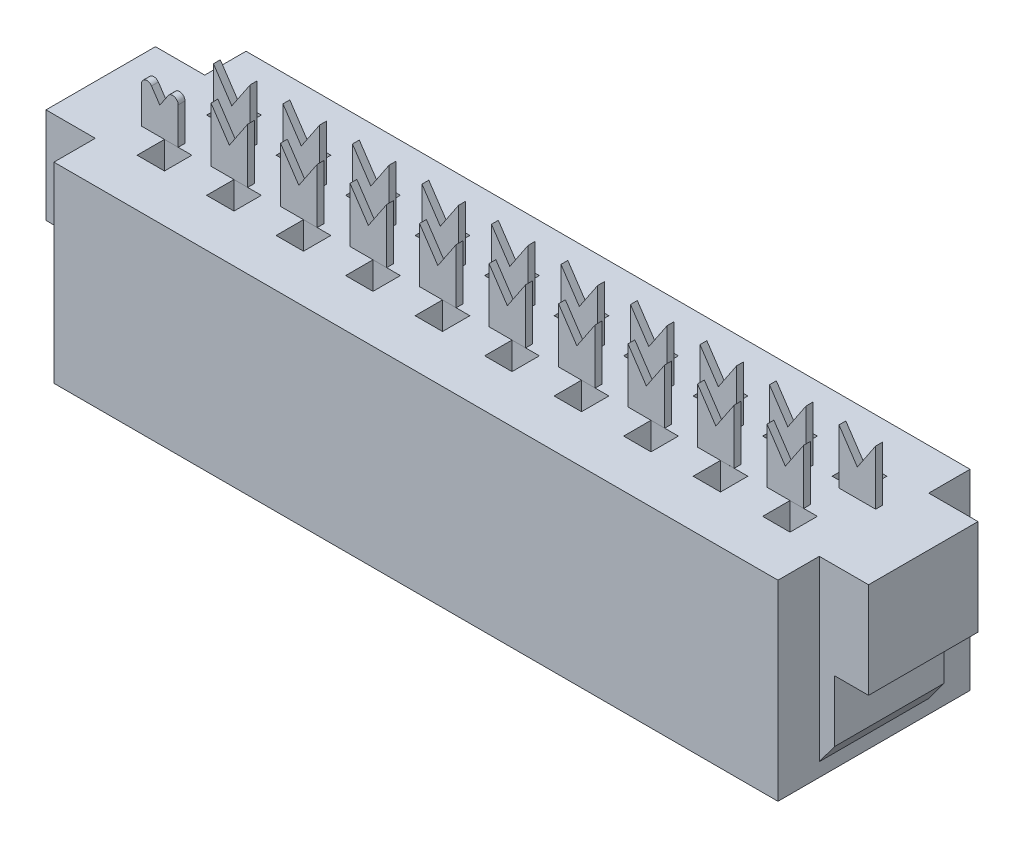
from build123d import *

# Parameters (mm, degrees)
SKETCH_1_W          = 1
SKETCH_1_H          = 1
EXTRUDE_1_DEPTH     = 7
SKETCH_5_W          = 1.34
SKETCH_5_H          = 0.25
EXTRUDE_3_DEPTH     = 2
EXTRUDE_3_2_DEPTH   = 2
EXTRUDE_3_3_DEPTH   = 2
EXTRUDE_3_4_DEPTH   = 2
EXTRUDE_3_5_DEPTH   = 2
EXTRUDE_3_6_DEPTH   = 2
EXTRUDE_3_7_DEPTH   = 2
EXTRUDE_3_8_DEPTH   = 2
EXTRUDE_3_9_DEPTH   = 2
EXTRUDE_3_10_DEPTH  = 2
EXTRUDE_3_11_DEPTH  = 2
EXTRUDE_3_12_DEPTH  = 2
EXTRUDE_3_13_DEPTH  = 2
EXTRUDE_3_14_DEPTH  = 2
EXTRUDE_3_15_DEPTH  = 2
EXTRUDE_3_16_DEPTH  = 2
EXTRUDE_3_17_DEPTH  = 2
EXTRUDE_3_18_DEPTH  = 2
EXTRUDE_3_19_DEPTH  = 2
EXTRUDE_3_20_DEPTH  = 2
CUT_EXTRUDE_1_DEPTH = 0.25
CUT_EXTRUDE_2_DEPTH = 0.25
CUT_EXTRUDE_START   = -5.51
CUT_EXTRUDE_3_DEPTH = 4
FILLET_1_R          = 0.2


with BuildPart() as part:
    # Эскиз1 → Бобышка-Вытянуть1 (new body)
    with BuildSketch(Plane(origin=(0, 0, 0), x_dir=(1, 0, 0), z_dir=(0, 1, 0))):
        Polygon((26.46, -0.73), (26.46, 3.27), (24.66, 3.27), (24.66, 4.78), (-1.8, 4.78), (-1.8, 3.27), (-3.6, 3.27), (-3.6, -0.73), (-1.8, -0.73), (-1.8, -2.24), (24.66, -2.24), (24.66, -0.73), align=None)
        Rectangle(SKETCH_1_W, SKETCH_1_H, mode=Mode.SUBTRACT)
        with Locations((2.54, 0)):
            Rectangle(SKETCH_1_W, SKETCH_1_H, mode=Mode.SUBTRACT)
        with Locations((2.54, 2.54)):
            Rectangle(SKETCH_1_W, SKETCH_1_H, mode=Mode.SUBTRACT)
        with Locations((0, 2.54)):
            Rectangle(SKETCH_1_W, SKETCH_1_H, mode=Mode.SUBTRACT)
        with Locations((5.08, 0)):
            Rectangle(SKETCH_1_W, SKETCH_1_H, mode=Mode.SUBTRACT)
        with Locations((7.62, 0)):
            Rectangle(SKETCH_1_W, SKETCH_1_H, mode=Mode.SUBTRACT)
        with Locations((10.16, 0)):
            Rectangle(SKETCH_1_W, SKETCH_1_H, mode=Mode.SUBTRACT)
        with Locations((12.7, 0)):
            Rectangle(SKETCH_1_W, SKETCH_1_H, mode=Mode.SUBTRACT)
        with Locations((15.24, 0)):
            Rectangle(SKETCH_1_W, SKETCH_1_H, mode=Mode.SUBTRACT)
        with Locations((17.78, 0)):
            Rectangle(SKETCH_1_W, SKETCH_1_H, mode=Mode.SUBTRACT)
        with Locations((20.32, 0)):
            Rectangle(SKETCH_1_W, SKETCH_1_H, mode=Mode.SUBTRACT)
        with Locations((22.86, 0)):
            Rectangle(SKETCH_1_W, SKETCH_1_H, mode=Mode.SUBTRACT)
        with Locations((5.08, 2.54)):
            Rectangle(SKETCH_1_W, SKETCH_1_H, mode=Mode.SUBTRACT)
        with Locations((7.62, 2.54)):
            Rectangle(SKETCH_1_W, SKETCH_1_H, mode=Mode.SUBTRACT)
        with Locations((10.16, 2.54)):
            Rectangle(SKETCH_1_W, SKETCH_1_H, mode=Mode.SUBTRACT)
        with Locations((12.7, 2.54)):
            Rectangle(SKETCH_1_W, SKETCH_1_H, mode=Mode.SUBTRACT)
        with Locations((15.24, 2.54)):
            Rectangle(SKETCH_1_W, SKETCH_1_H, mode=Mode.SUBTRACT)
        with Locations((17.78, 2.54)):
            Rectangle(SKETCH_1_W, SKETCH_1_H, mode=Mode.SUBTRACT)
        with Locations((20.32, 2.54)):
            Rectangle(SKETCH_1_W, SKETCH_1_H, mode=Mode.SUBTRACT)
        with Locations((22.86, 2.54)):
            Rectangle(SKETCH_1_W, SKETCH_1_H, mode=Mode.SUBTRACT)
    extrude(amount=EXTRUDE_1_DEPTH)

    # Эскиз8 → Вырез-Вытянуть3 (cut)
    with BuildSketch(Plane.XY.offset(2.24).offset(CUT_EXTRUDE_START)):
        Polygon((-1.8, 0), (-1.8, 0.5), (-2.35, 1.25), (-2.35, 3.5), (-3.6, 3.5), (-3.6, 0), align=None)
        Polygon((26.46, 0), (24.66, 0), (24.66, 0.5), (25.21, 1.25), (25.21, 3.5), (26.46, 3.5), align=None)
    extrude(amount=CUT_EXTRUDE_3_DEPTH, mode=Mode.SUBTRACT)


with BuildPart() as body_2:
    # Эскиз5 → Бобышка-Вытянуть3 (new body)
    with BuildSketch(Plane(origin=(0, 7, 0), x_dir=(1, 0, 0), z_dir=(0, 1, 0))):
        with Locations((-0.67, 0.625)):
            Rectangle(SKETCH_5_W, SKETCH_5_H)
    extrude(amount=EXTRUDE_3_DEPTH)


with BuildPart() as body_3:
    # Эскиз5 → Extrude 3 2 (new body)
    with BuildSketch(Plane(origin=(0, 7, 0), x_dir=(1, 0, 0), z_dir=(0, 1, 0))):
        with Locations((0.67, 1.915)):
            Rectangle(SKETCH_5_W, SKETCH_5_H)
    extrude(amount=EXTRUDE_3_2_DEPTH)


with BuildPart() as body_4:
    # Эскиз5 → Extrude 3 3 (new body)
    with BuildSketch(Plane(origin=(0, 7, 0), x_dir=(1, 0, 0), z_dir=(0, 1, 0))):
        with Locations((3.21, 1.915)):
            Rectangle(SKETCH_5_W, SKETCH_5_H)
    extrude(amount=EXTRUDE_3_3_DEPTH)


with BuildPart() as body_5:
    # Эскиз5 → Extrude 3 4 (new body)
    with BuildSketch(Plane(origin=(0, 7, 0), x_dir=(1, 0, 0), z_dir=(0, 1, 0))):
        with Locations((1.87, 0.625)):
            Rectangle(SKETCH_5_W, SKETCH_5_H)
    extrude(amount=EXTRUDE_3_4_DEPTH)


with BuildPart() as body_6:
    # Эскиз5 → Extrude 3 5 (new body)
    with BuildSketch(Plane(origin=(0, 7, 0), x_dir=(1, 0, 0), z_dir=(0, 1, 0))):
        with Locations((5.75, 1.915)):
            Rectangle(SKETCH_5_W, SKETCH_5_H)
    extrude(amount=EXTRUDE_3_5_DEPTH)


with BuildPart() as body_7:
    # Эскиз5 → Extrude 3 6 (new body)
    with BuildSketch(Plane(origin=(0, 7, 0), x_dir=(1, 0, 0), z_dir=(0, 1, 0))):
        with Locations((4.41, 0.625)):
            Rectangle(SKETCH_5_W, SKETCH_5_H)
    extrude(amount=EXTRUDE_3_6_DEPTH)


with BuildPart() as body_8:
    # Эскиз5 → Extrude 3 7 (new body)
    with BuildSketch(Plane(origin=(0, 7, 0), x_dir=(1, 0, 0), z_dir=(0, 1, 0))):
        with Locations((8.29, 1.915)):
            Rectangle(SKETCH_5_W, SKETCH_5_H)
    extrude(amount=EXTRUDE_3_7_DEPTH)


with BuildPart() as body_9:
    # Эскиз5 → Extrude 3 8 (new body)
    with BuildSketch(Plane(origin=(0, 7, 0), x_dir=(1, 0, 0), z_dir=(0, 1, 0))):
        with Locations((6.95, 0.625)):
            Rectangle(SKETCH_5_W, SKETCH_5_H)
    extrude(amount=EXTRUDE_3_8_DEPTH)


with BuildPart() as body_10:
    # Эскиз5 → Extrude 3 9 (new body)
    with BuildSketch(Plane(origin=(0, 7, 0), x_dir=(1, 0, 0), z_dir=(0, 1, 0))):
        with Locations((10.83, 1.915)):
            Rectangle(SKETCH_5_W, SKETCH_5_H)
    extrude(amount=EXTRUDE_3_9_DEPTH)


with BuildPart() as body_11:
    # Эскиз5 → Extrude 3 10 (new body)
    with BuildSketch(Plane(origin=(0, 7, 0), x_dir=(1, 0, 0), z_dir=(0, 1, 0))):
        with Locations((9.49, 0.625)):
            Rectangle(SKETCH_5_W, SKETCH_5_H)
    extrude(amount=EXTRUDE_3_10_DEPTH)


with BuildPart() as body_12:
    # Эскиз5 → Extrude 3 11 (new body)
    with BuildSketch(Plane(origin=(0, 7, 0), x_dir=(1, 0, 0), z_dir=(0, 1, 0))):
        with Locations((13.37, 1.915)):
            Rectangle(SKETCH_5_W, SKETCH_5_H)
    extrude(amount=EXTRUDE_3_11_DEPTH)


with BuildPart() as body_13:
    # Эскиз5 → Extrude 3 12 (new body)
    with BuildSketch(Plane(origin=(0, 7, 0), x_dir=(1, 0, 0), z_dir=(0, 1, 0))):
        with Locations((12.03, 0.625)):
            Rectangle(SKETCH_5_W, SKETCH_5_H)
    extrude(amount=EXTRUDE_3_12_DEPTH)


with BuildPart() as body_14:
    # Эскиз5 → Extrude 3 13 (new body)
    with BuildSketch(Plane(origin=(0, 7, 0), x_dir=(1, 0, 0), z_dir=(0, 1, 0))):
        with Locations((15.91, 1.915)):
            Rectangle(SKETCH_5_W, SKETCH_5_H)
    extrude(amount=EXTRUDE_3_13_DEPTH)


with BuildPart() as body_15:
    # Эскиз5 → Extrude 3 14 (new body)
    with BuildSketch(Plane(origin=(0, 7, 0), x_dir=(1, 0, 0), z_dir=(0, 1, 0))):
        with Locations((14.57, 0.625)):
            Rectangle(SKETCH_5_W, SKETCH_5_H)
    extrude(amount=EXTRUDE_3_14_DEPTH)


with BuildPart() as body_16:
    # Эскиз5 → Extrude 3 15 (new body)
    with BuildSketch(Plane(origin=(0, 7, 0), x_dir=(1, 0, 0), z_dir=(0, 1, 0))):
        with Locations((18.45, 1.915)):
            Rectangle(SKETCH_5_W, SKETCH_5_H)
    extrude(amount=EXTRUDE_3_15_DEPTH)


with BuildPart() as body_17:
    # Эскиз5 → Extrude 3 16 (new body)
    with BuildSketch(Plane(origin=(0, 7, 0), x_dir=(1, 0, 0), z_dir=(0, 1, 0))):
        with Locations((17.11, 0.625)):
            Rectangle(SKETCH_5_W, SKETCH_5_H)
    extrude(amount=EXTRUDE_3_16_DEPTH)


with BuildPart() as body_18:
    # Эскиз5 → Extrude 3 17 (new body)
    with BuildSketch(Plane(origin=(0, 7, 0), x_dir=(1, 0, 0), z_dir=(0, 1, 0))):
        with Locations((20.99, 1.915)):
            Rectangle(SKETCH_5_W, SKETCH_5_H)
    extrude(amount=EXTRUDE_3_17_DEPTH)


with BuildPart() as body_19:
    # Эскиз5 → Extrude 3 18 (new body)
    with BuildSketch(Plane(origin=(0, 7, 0), x_dir=(1, 0, 0), z_dir=(0, 1, 0))):
        with Locations((19.65, 0.625)):
            Rectangle(SKETCH_5_W, SKETCH_5_H)
    extrude(amount=EXTRUDE_3_18_DEPTH)


with BuildPart() as body_20:
    # Эскиз5 → Extrude 3 19 (new body)
    with BuildSketch(Plane(origin=(0, 7, 0), x_dir=(1, 0, 0), z_dir=(0, 1, 0))):
        with Locations((23.53, 1.915)):
            Rectangle(SKETCH_5_W, SKETCH_5_H)
    extrude(amount=EXTRUDE_3_19_DEPTH)


with BuildPart() as body_21:
    # Эскиз5 → Extrude 3 20 (new body)
    with BuildSketch(Plane(origin=(0, 7, 0), x_dir=(1, 0, 0), z_dir=(0, 1, 0))):
        with Locations((22.19, 0.625)):
            Rectangle(SKETCH_5_W, SKETCH_5_H)
    extrude(amount=EXTRUDE_3_20_DEPTH)


with BuildPart() as cut_extrude_1_tool:
    # Эскиз6 → Вырез-Вытянуть1 (new body)
    with BuildSketch(Plane.XY.offset(-0.5)):
        Polygon((0, 9), (-1.34, 9), (-0.67, 8), align=None)
        Polygon((1.87, 8), (2.54, 9), (1.2, 9), align=None)
        Polygon((4.41, 8), (5.08, 9), (3.74, 9), align=None)
        Polygon((6.95, 8), (7.62, 9), (6.28, 9), align=None)
        Polygon((9.49, 8), (10.16, 9), (8.82, 9), align=None)
        Polygon((12.03, 8), (12.7, 9), (11.36, 9), align=None)
        Polygon((14.57, 8), (15.24, 9), (13.9, 9), align=None)
        Polygon((17.11, 8), (17.78, 9), (16.44, 9), align=None)
        Polygon((19.65, 8), (20.32, 9), (18.98, 9), align=None)
        Polygon((22.19, 8), (22.86, 9), (21.52, 9), align=None)
    extrude(amount=-CUT_EXTRUDE_1_DEPTH)


with BuildPart() as body_2_1:
    add(body_2.part)

    # Вырез-Вытянуть1: cut by cut_extrude_1_tool
    add(cut_extrude_1_tool.part, mode=Mode.SUBTRACT)

    # Скругление1
    fillet_1_edges = [body_2_1.edges().sort_by_distance(p)[0] for p in [
        (0, 9, -0.625),
        (-1.34, 9, -0.625),
    ]]
    fillet(fillet_1_edges, radius=FILLET_1_R)


with BuildPart() as body_5_1:
    add(body_5.part)

    # Вырез-Вытянуть1: cut by cut_extrude_1_tool
    add(cut_extrude_1_tool.part, mode=Mode.SUBTRACT)


with BuildPart() as body_7_1:
    add(body_7.part)

    # Вырез-Вытянуть1: cut by cut_extrude_1_tool
    add(cut_extrude_1_tool.part, mode=Mode.SUBTRACT)


with BuildPart() as body_9_1:
    add(body_9.part)

    # Вырез-Вытянуть1: cut by cut_extrude_1_tool
    add(cut_extrude_1_tool.part, mode=Mode.SUBTRACT)


with BuildPart() as body_11_1:
    add(body_11.part)

    # Вырез-Вытянуть1: cut by cut_extrude_1_tool
    add(cut_extrude_1_tool.part, mode=Mode.SUBTRACT)


with BuildPart() as body_13_1:
    add(body_13.part)

    # Вырез-Вытянуть1: cut by cut_extrude_1_tool
    add(cut_extrude_1_tool.part, mode=Mode.SUBTRACT)


with BuildPart() as body_15_1:
    add(body_15.part)

    # Вырез-Вытянуть1: cut by cut_extrude_1_tool
    add(cut_extrude_1_tool.part, mode=Mode.SUBTRACT)


with BuildPart() as body_17_1:
    add(body_17.part)

    # Вырез-Вытянуть1: cut by cut_extrude_1_tool
    add(cut_extrude_1_tool.part, mode=Mode.SUBTRACT)


with BuildPart() as body_19_1:
    add(body_19.part)

    # Вырез-Вытянуть1: cut by cut_extrude_1_tool
    add(cut_extrude_1_tool.part, mode=Mode.SUBTRACT)


with BuildPart() as body_21_1:
    add(body_21.part)

    # Вырез-Вытянуть1: cut by cut_extrude_1_tool
    add(cut_extrude_1_tool.part, mode=Mode.SUBTRACT)


with BuildPart() as cut_extrude_2_tool:
    # Эскиз7 → Вырез-Вытянуть2 (new body)
    with BuildSketch(Plane.XY.offset(-1.79)):
        Polygon((0, 9), (0.67, 8), (1.34, 9), align=None)
        Polygon((2.54, 9), (3.21, 8), (3.88, 9), align=None)
        Polygon((5.08, 9), (5.75, 8), (6.42, 9), align=None)
        Polygon((7.62, 9), (8.29, 8), (8.96, 9), align=None)
        Polygon((10.16, 9), (10.83, 8), (11.5, 9), align=None)
        Polygon((12.7, 9), (13.37, 8), (14.04, 9), align=None)
        Polygon((15.24, 9), (15.91, 8), (16.58, 9), align=None)
        Polygon((17.78, 9), (18.45, 8), (19.12, 9), align=None)
        Polygon((20.32, 9), (20.99, 8), (21.66, 9), align=None)
        Polygon((22.86, 9), (23.53, 8), (24.2, 9), align=None)
    extrude(amount=-CUT_EXTRUDE_2_DEPTH)


with BuildPart() as body_3_1:
    add(body_3.part)

    # Вырез-Вытянуть2: cut by cut_extrude_2_tool
    add(cut_extrude_2_tool.part, mode=Mode.SUBTRACT)


with BuildPart() as body_4_1:
    add(body_4.part)

    # Вырез-Вытянуть2: cut by cut_extrude_2_tool
    add(cut_extrude_2_tool.part, mode=Mode.SUBTRACT)


with BuildPart() as body_6_1:
    add(body_6.part)

    # Вырез-Вытянуть2: cut by cut_extrude_2_tool
    add(cut_extrude_2_tool.part, mode=Mode.SUBTRACT)


with BuildPart() as body_8_1:
    add(body_8.part)

    # Вырез-Вытянуть2: cut by cut_extrude_2_tool
    add(cut_extrude_2_tool.part, mode=Mode.SUBTRACT)


with BuildPart() as body_10_1:
    add(body_10.part)

    # Вырез-Вытянуть2: cut by cut_extrude_2_tool
    add(cut_extrude_2_tool.part, mode=Mode.SUBTRACT)


with BuildPart() as body_12_1:
    add(body_12.part)

    # Вырез-Вытянуть2: cut by cut_extrude_2_tool
    add(cut_extrude_2_tool.part, mode=Mode.SUBTRACT)


with BuildPart() as body_14_1:
    add(body_14.part)

    # Вырез-Вытянуть2: cut by cut_extrude_2_tool
    add(cut_extrude_2_tool.part, mode=Mode.SUBTRACT)


with BuildPart() as body_16_1:
    add(body_16.part)

    # Вырез-Вытянуть2: cut by cut_extrude_2_tool
    add(cut_extrude_2_tool.part, mode=Mode.SUBTRACT)


with BuildPart() as body_18_1:
    add(body_18.part)

    # Вырез-Вытянуть2: cut by cut_extrude_2_tool
    add(cut_extrude_2_tool.part, mode=Mode.SUBTRACT)


with BuildPart() as body_20_1:
    add(body_20.part)

    # Вырез-Вытянуть2: cut by cut_extrude_2_tool
    add(cut_extrude_2_tool.part, mode=Mode.SUBTRACT)


solid = Compound([part.part, body_2_1.part, body_5_1.part, body_7_1.part, body_9_1.part, body_11_1.part, body_13_1.part, body_15_1.part, body_17_1.part, body_19_1.part, body_21_1.part, body_3_1.part, body_4_1.part, body_6_1.part, body_8_1.part, body_10_1.part, body_12_1.part, body_14_1.part, body_16_1.part, body_18_1.part, body_20_1.part])
